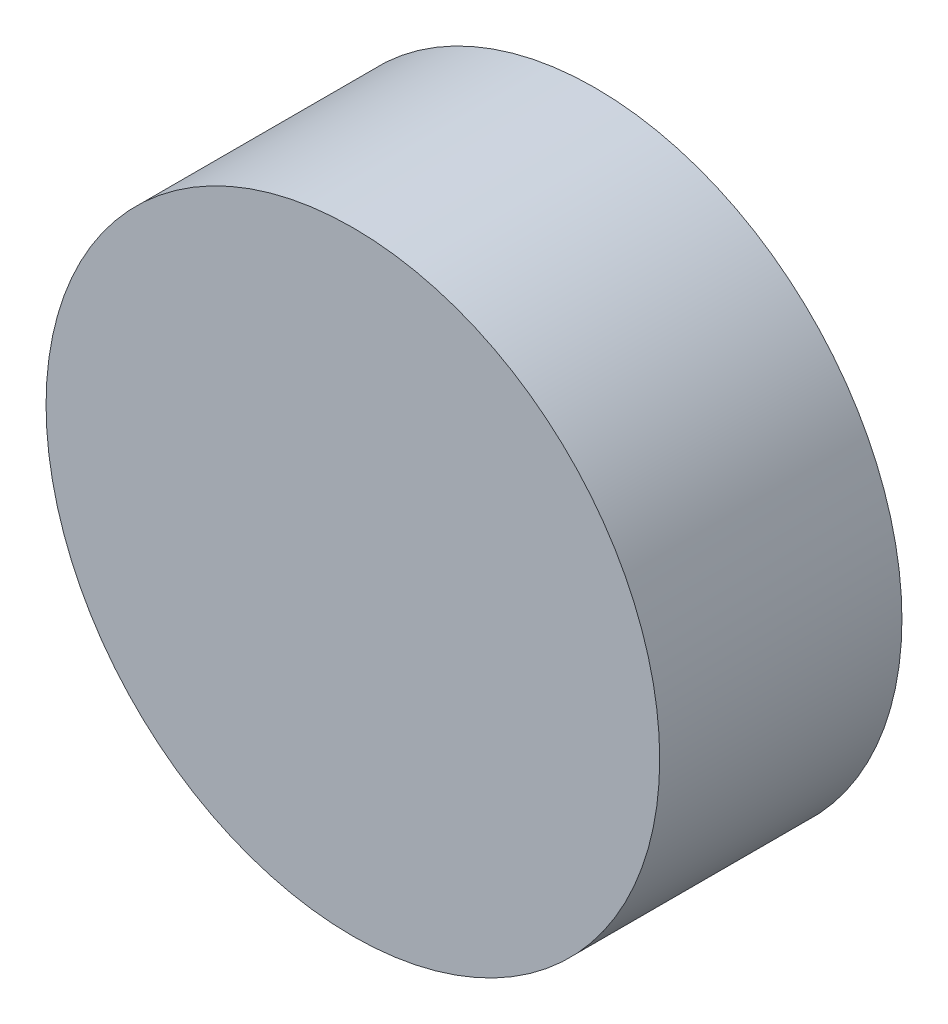
from build123d import *

# Parameters (mm, degrees)
ESQUISSE1_R        = 3.8
BOSS_EXTRU_2_DEPTH = 3


with BuildPart() as part:
    # Esquisse1 → Boss.-Extru.2 (new body)
    with BuildSketch(Plane.XY):
        Circle(ESQUISSE1_R)
    extrude(amount=BOSS_EXTRU_2_DEPTH)


solid = part.part
